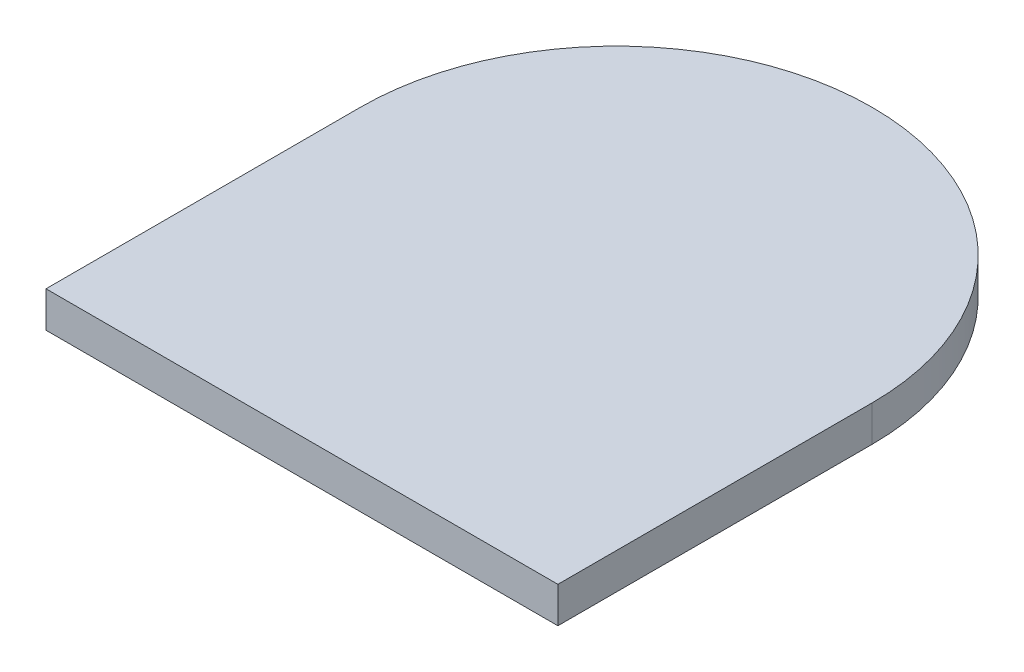
from build123d import *

# Parameters (mm, degrees)
EXTRUDE_1_DEPTH = 4


with BuildPart() as part:
    # 草图1 → 凸台-拉伸1 (new body)
    with BuildSketch(Plane(origin=(0, 0, 0), x_dir=(1, 0, 0), z_dir=(0, 1, 0))):
        with BuildLine():
            Line((-28.5, 0), (-28.5, -35))
            Line((-28.5, -35), (28.5, -35))
            Line((28.5, -35), (28.5, 0))
            ThreePointArc((28.5, 0), (0, 28.5), (-28.5, 0))
        make_face()
    extrude(amount=EXTRUDE_1_DEPTH)


solid = part.part
